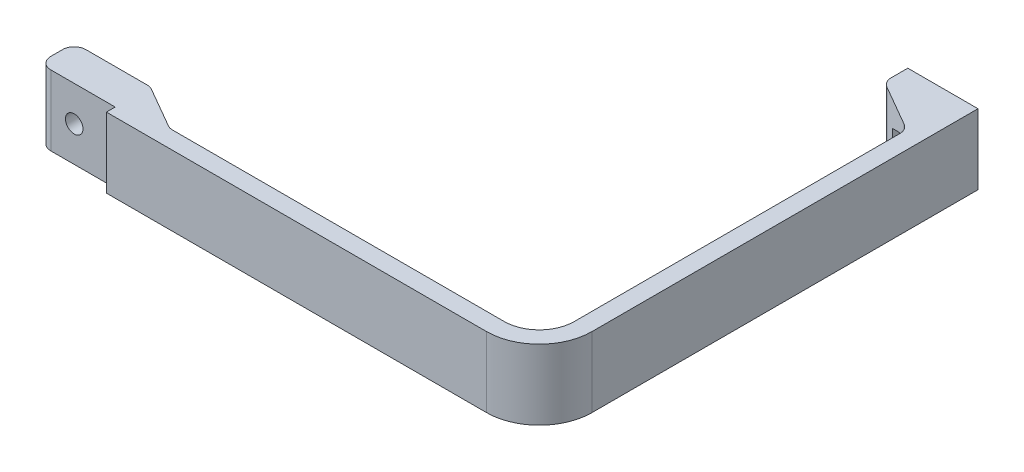
from build123d import *

# Parameters (mm, degrees)
BOSS_EXTRU_1_DEPTH      = 6
ESQUISSE2_R             = 1.5
ENL_V_MAT_EXTRU_1_DEPTH = 12
ESQUISSE3_R             = 1.5
ENL_V_MAT_EXTRU_2_DEPTH = 12
CONG_1_R                = 2
ENL_V_MAT_EXTRU_3_DEPTH = 3
ENL_V_START             = -3
ENL_V_MAT_EXTRU_4_DEPTH = 10


with BuildPart() as part:
    # Esquisse1 → Boss.-Extru.1 (new, symmetric)
    with BuildSketch(Plane(origin=(0, 0, 0), x_dir=(1, 0, 0), z_dir=(0, 1, 0))):
        with BuildLine():
            Line((-12, 0), (0, 0))
            Line((0, 0), (0, -66))
            ThreePointArc((0, -66), (-2.636038969, -72.363961031), (-9, -75))
            Line((-9, -75), (-74, -75))
            Line((-74, -75), (-74, -73.5))
            Line((-74, -73.5), (-87, -73.5))
            Line((-87, -73.5), (-87, -67.5))
            Line((-87, -67.5), (-74, -67.5))
            Line((-74, -67.5), (-66.205771366, -72))
            Line((-66.205771366, -72), (-9, -72))
            ThreePointArc((-9, -72), (-4.757359313, -70.242640687), (-3, -66))
            Line((-3, -66), (-3, -9.196152423))
            Line((-3, -9.196152423), (-12, -4))
            Line((-12, -4), (-12, 0))
        make_face()
    extrude(amount=BOSS_EXTRU_1_DEPTH, both=True)

    # Esquisse2 → Enlèv. mat.-Extru.1 (cut)
    with BuildSketch(Plane(origin=(0, 0, 0), x_dir=(-1, 0, 0), z_dir=(0, 0, -1))):
        with Locations((6, 0)):
            Circle(ESQUISSE2_R)
    extrude(amount=-ENL_V_MAT_EXTRU_1_DEPTH, mode=Mode.SUBTRACT)

    # Esquisse3 → Enlèv. mat.-Extru.2 (cut)
    with BuildSketch(Plane(origin=(0, 0, 67.5), x_dir=(-1, 0, 0), z_dir=(0, 0, -1))):
        with Locations((81, 0)):
            Circle(ESQUISSE3_R)
    extrude(amount=-ENL_V_MAT_EXTRU_2_DEPTH, mode=Mode.SUBTRACT)

    # Congé1
    cong_1_edges = [part.edges().sort_by_distance(p)[0] for p in [
        (-87, 0, 73.5),
        (-87, 0, 67.5),
        (-74, 0, 67.5),
        (-66.205771366, 0, 72),
        (-3, 0, 9.196152423),
        (-12, 0, 4),
    ]]
    fillet(cong_1_edges, radius=CONG_1_R)

    # Esquisse4 → Enlèv. mat.-Extru.3 (cut)
    with BuildSketch(Plane(origin=(0, 0, 67.5), x_dir=(-1, 0, 0), z_dir=(0, 0, -1))):
        Polygon((83.8, 1.616580754), (81, 3.233161507), (78.2, 1.616580754), (78.2, -1.616580754), (81, -3.233161507), (83.8, -1.616580754), align=None)
    extrude(amount=-ENL_V_MAT_EXTRU_3_DEPTH, mode=Mode.SUBTRACT)

    # Esquisse5 → Enlèv. mat.-Extru.4 (cut)
    with BuildSketch(Plane(origin=(0, 0, 0), x_dir=(-1, 0, 0), z_dir=(0, 0, -1)).offset(ENL_V_START)):
        Polygon((8.8, 1.616580754), (6, 3.233161507), (3.2, 1.616580754), (3.2, -1.616580754), (6, -3.233161507), (8.8, -1.616580754), align=None)
    extrude(amount=-ENL_V_MAT_EXTRU_4_DEPTH, mode=Mode.SUBTRACT)


solid = part.part
